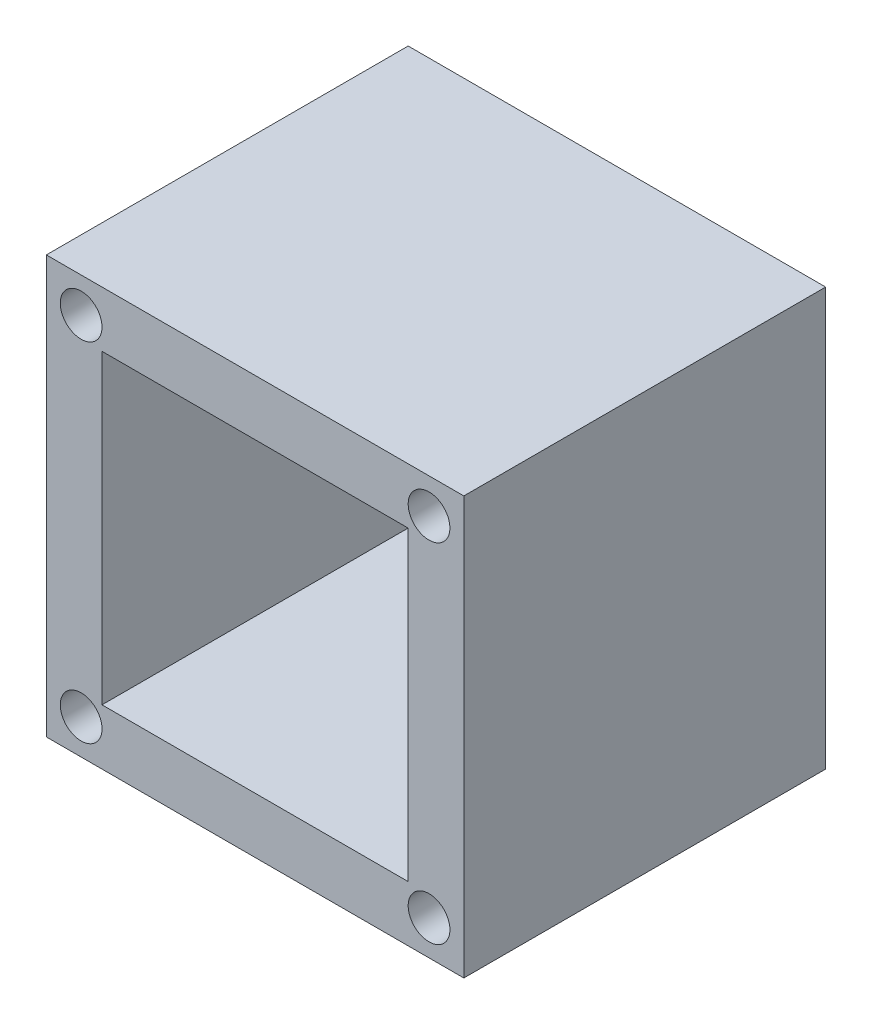
from build123d import *

# Parameters (mm, degrees)
CROQUIS1_W              = 30
CROQUIS1_H              = 30
CROQUIS1_R              = 1
SALIENTE_EXTRUIR2_DEPTH = 1
CROQUIS2_W              = 30
CROQUIS2_H              = 30
CROQUIS2_W_2            = 22
CROQUIS2_H_2            = 22
SALIENTE_EXTRUIR3_DEPTH = 30
CROQUIS4_R              = 1.5
CORTAR_EXTRUIR2_DEPTH   = 44
CROQUIS6_W              = 5
CROQUIS6_H              = 30
CORTAR_EXTRUIR4_DEPTH   = 46


with BuildPart() as part:
    # Croquis1 → Saliente-Extruir2 (new body)
    with BuildSketch(Plane.XY):
        Rectangle(CROQUIS1_W, CROQUIS1_H)
        with Locations((-8, 0)):
            Circle(CROQUIS1_R, mode=Mode.SUBTRACT)
        with Locations((8, 0)):
            Circle(CROQUIS1_R, mode=Mode.SUBTRACT)
        with BuildLine():
            Line((-1.75, 4.25), (1.75, 4.25))
            ThreePointArc((1.75, 4.25), (6, 0), (1.75, -4.25))
            Line((1.75, -4.25), (-1.75, -4.25))
            ThreePointArc((-1.75, -4.25), (-6, 0), (-1.75, 4.25))
        make_face(mode=Mode.SUBTRACT)
    extrude(amount=-SALIENTE_EXTRUIR2_DEPTH)

    # Croquis2 → Saliente-Extruir3 (add)
    with BuildSketch(Plane.XY):
        Rectangle(CROQUIS2_W, CROQUIS2_H)
        Rectangle(CROQUIS2_W_2, CROQUIS2_H_2, mode=Mode.SUBTRACT)
    extrude(amount=SALIENTE_EXTRUIR3_DEPTH)

    # Croquis4 → Cortar-Extruir2 (cut)
    with BuildSketch(Plane.XY.offset(30)):
        with Locations((-12.5, 12.5)):
            Circle(CROQUIS4_R)
        with Locations((12.5, 12.5)):
            Circle(CROQUIS4_R)
        with Locations((12.5, -12.5)):
            Circle(CROQUIS4_R)
        with Locations((-12.5, -12.5)):
            Circle(CROQUIS4_R)
    extrude(amount=-CORTAR_EXTRUIR2_DEPTH, mode=Mode.SUBTRACT)

    # Croquis6 → Cortar-Extruir4 (cut)
    with BuildSketch(Plane.ZY.offset(15)):
        with Locations((1.5, 0)):
            Rectangle(CROQUIS6_W, CROQUIS6_H)
    extrude(amount=-CORTAR_EXTRUIR4_DEPTH, mode=Mode.SUBTRACT)


solid = part.part
